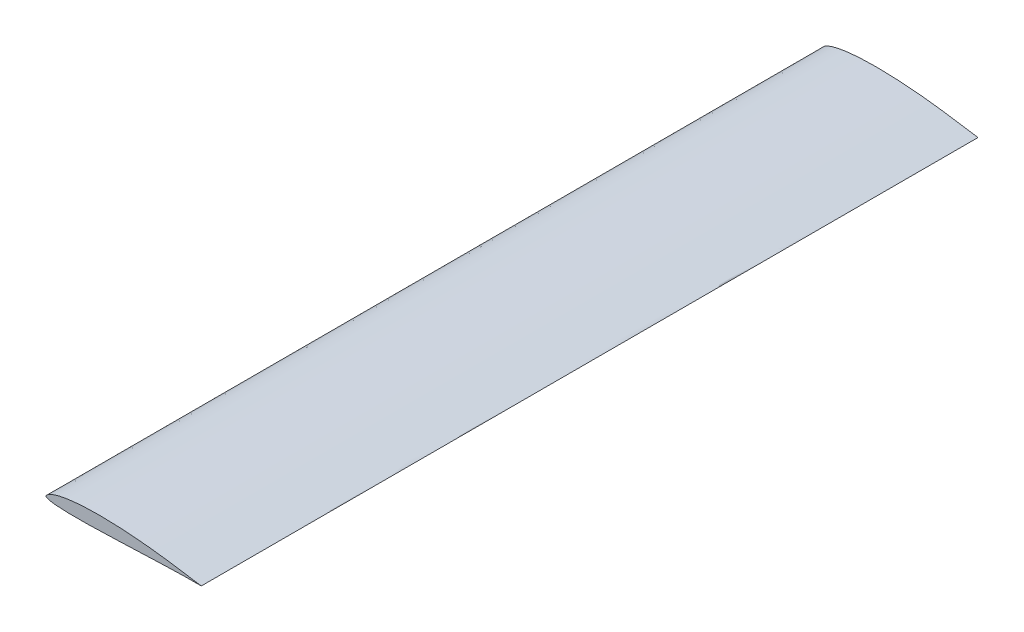
from build123d import *

# Parameters (mm, degrees)
BOSS_EXTRUDE1_DEPTH = 250
SKETCH2_W           = 3
SKETCH2_H           = 1
BOSS_EXTRUDE2_DEPTH = 1


with BuildPart() as part:
    # Sketch1 → Boss-Extrude1 (new body)
    with BuildSketch(Plane.XY):
        with BuildLine():
            add(Edge.make_bspline(
                [(50, 0), (50.000127321, 0.002422792), (49.652184009, 0.032958621), (49.301097208, 0.083188509), (48.459274004, 0.194453497), (47.441479646, 0.349875411), (46.133776608, 0.554864154), (44.615485046, 0.799310742), (42.892312753, 1.07508556), (40.995754148, 1.370980431), (38.94771753, 1.674669482), (36.770322955, 1.971115616), (34.483839246, 2.249761345), (32.108990986, 2.504840128), (29.66860858, 2.732239843), (27.188921164, 2.931782342), (24.697141476, 3.099622867), (22.218817139, 3.225155168), (19.778447637, 3.304800695), (17.399570259, 3.338767304), (15.104318179, 3.320960878), (12.913773107, 3.249229887), (10.847546414, 3.129619148), (8.924509706, 2.959577327), (7.161287843, 2.740428866), (5.571517506, 2.476714534), (4.16707883, 2.17390075), (2.957626952, 1.83762559), (1.950465142, 1.477263452), (1.148816473, 1.103045788), (0.558729346, 0.731078994), (0.228075961, 0.436603357), (0.089992171, 0.239435058), (0.040814575, 0.152213957), (0.010449843, 0.073827097), (-0.001543212, 0.012029906), (0.000871812, -0.036665913), (0.024720092, -0.080378542), (0.069417909, -0.130458815), (0.141050471, -0.188547481), (0.314418628, -0.296228741), (0.700511343, -0.453609623), (1.378093814, -0.628171654), (2.337457247, -0.787734756), (3.538967448, -0.918209355), (4.974167945, -1.015410816), (6.631209203, -1.07934352), (8.495610444, -1.110654464), (10.549669024, -1.111991231), (12.77276295, -1.086785548), (15.141440561, -1.038931402), (17.629849017, -0.972256842), (20.210338001, -0.890564709), (22.853820047, -0.797649566), (25.530288492, -0.69692322), (28.20906111, -0.592479053), (30.859040964, -0.487645246), (33.448999851, -0.386619732), (35.947841946, -0.292376734), (38.325016638, -0.208048773), (40.551004266, -0.135849855), (42.596395244, -0.078478019), (44.436055182, -0.036461301), (46.037752375, -0.009148581), (47.398981695, 0.004310281), (48.444054367, 0.00956179), (49.297247507, 0.004211274), (49.651501088, 0.008982102), (49.999872564, -0.00242498), (50, 0)],
                knots=[0, 0, 0, 0, 0.00163101, 0.006435235, 0.014220669, 0.024765625, 0.037826727, 0.053149348, 0.070473504, 0.089535694, 0.110075428, 0.131859875, 0.154692567, 0.178371256, 0.202679512, 0.227363961, 0.252132687, 0.276728351, 0.300939435, 0.324527111, 0.347267377, 0.368991726, 0.389507471, 0.40862838, 0.426224009, 0.442178728, 0.456395551, 0.468805124, 0.479372318, 0.488085518, 0.494967924, 0.50003381, 0.501035663, 0.50209449, 0.502996978, 0.50351288, 0.503955826, 0.504408894, 0.504955423, 0.505942626, 0.507129614, 0.510997735, 0.518231919, 0.527845532, 0.539808758, 0.554055915, 0.570489592, 0.588973674, 0.609342058, 0.631392897, 0.654894034, 0.679589725, 0.705203145, 0.731446604, 0.758020282, 0.784619628, 0.810935624, 0.836656653, 0.861473352, 0.885081475, 0.907187944, 0.927507338, 0.945765257, 0.961711874, 0.975121793, 0.985796266, 0.993581185, 0.998367518, 1, 1, 1, 1], degree=3))
        make_face()
    extrude(amount=BOSS_EXTRUDE1_DEPTH)

    # Sketch2 → Boss-Extrude2 (add)
    with BuildSketch(Plane(origin=(0, 0, 0), x_dir=(-1, 0, 0), z_dir=(0, 0, -1))):
        with Locations((-16.973, 1.09)):
            Rectangle(SKETCH2_W, SKETCH2_H)
    extrude(amount=BOSS_EXTRUDE2_DEPTH)


solid = part.part
